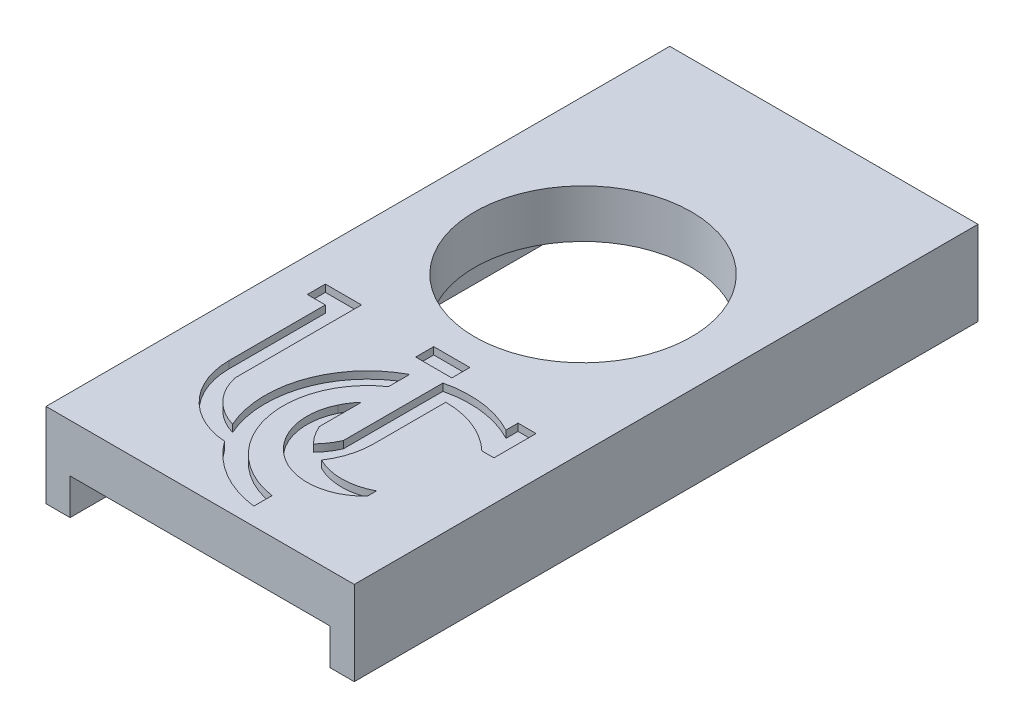
from build123d import *

# Parameters (mm, degrees)
SKETCH1_W           = 12.8
SKETCH1_H           = 25.9
SKETCH1_W_2         = 10.8
SKETCH1_H_2         = 21.9
BOSS_EXTRUDE1_DEPTH = 3.5
SKETCH3_W           = 10.8
SKETCH3_H           = 1.5
CUT_EXTRUDE1_DEPTH  = 15.863125512
SKETCH4_W           = 10.8
SKETCH4_H           = 21.9
SKETCH4_R           = 4.5
BOSS_EXTRUDE2_DEPTH = 2
SKETCH5_W           = 1.5
SKETCH5_H           = 0.75
CUT_EXTRUDE2_DEPTH  = 0.3


with BuildPart() as part:
    # Sketch1 → Boss-Extrude1 (new body)
    with BuildSketch(Plane(origin=(0, 0, 0), x_dir=(1, 0, 0), z_dir=(0, 1, 0))):
        Rectangle(SKETCH1_W, SKETCH1_H)
        Rectangle(SKETCH1_W_2, SKETCH1_H_2, mode=Mode.SUBTRACT)
    extrude(amount=BOSS_EXTRUDE1_DEPTH)

    # Sketch3 → Cut-Extrude1 (cut, through all)
    with BuildSketch(Plane.XY):
        with Locations((0, 0.75)):
            Rectangle(SKETCH3_W, SKETCH3_H)
    extrude(amount=CUT_EXTRUDE1_DEPTH, mode=Mode.SUBTRACT)

    # Sketch4 → Boss-Extrude2 (add)
    with BuildSketch(Plane(origin=(0, 3.5, 0), x_dir=(1, 0, 0), z_dir=(0, 1, 0))):
        Rectangle(SKETCH4_W, SKETCH4_H)
        with Locations(Location((0, 2.95, 0), (0, 0, 270))):
            Circle(SKETCH4_R, mode=Mode.SUBTRACT)
    extrude(amount=-BOSS_EXTRUDE2_DEPTH)

    # Sketch5 → Cut-Extrude2 (cut)
    with BuildSketch(Plane(origin=(0, 3.5, 0), x_dir=(1, 0, 0), z_dir=(0, 1, 0))):
        with BuildLine():
            Line((0, -6.25), (0, -8))
            ThreePointArc((0, -8), (0.216665991, -8.397222673), (0.5, -8.75))
            ThreePointArc((0.5, -8.75), (0.783334009, -8.397222673), (1, -8))
            Line((1, -8), (1, -3.86932209))
            ThreePointArc((1, -3.86932209), (2.535003662, -3.783808462), (4, -4.25))
            Line((4, -4.25), (4, -3.75))
            Line((4, -3.75), (4.75, -3.75))
            Line((4.75, -3.75), (4.75, -5.5))
            Line((4.75, -5.5), (4.25, -5.5))
            ThreePointArc((4.25, -5.5), (3.096291202, -4.759271996), (1.75, -4.5))
            Line((1.75, -4.5), (1.75, -7.5))
            ThreePointArc((1.75, -7.5), (1.622281323, -8.366025404), (1.25, -9.158312395))
            ThreePointArc((1.25, -9.158312395), (2.379117111, -9.416714281), (3.5, -9.124655157))
            Line((3.5, -9.124655157), (3.5, -9.5))
            ThreePointArc((3.5, -9.5), (0.408776976, -9.847754603), (-0.391896371, -6.841841224))
            ThreePointArc((-0.391896371, -6.841841224), (-0.215797248, -6.532777264), (0, -6.25))
        make_face()
        with BuildLine():
            Line((-4.25, -3.5), (-4.25, -7.5))
            ThreePointArc((-4.25, -7.5), (-3.437933175, -9.552546813), (-1.44136772, -10.493890178))
            ThreePointArc((-1.44136772, -10.493890178), (-0.151482732, -11.665190589), (1.5, -12.220485754))
            Line((1.5, -12.220485754), (1.5, -11.464101615))
            ThreePointArc((1.5, -11.464101615), (-1.405868052, -8.80626473), (0, -5.127718677))
            Line((0, -5.127718677), (0, -4.25))
            ThreePointArc((0, -4.25), (-2.016828361, -6.611623278), (-1.88878465, -9.714600228))
            ThreePointArc((-1.88878465, -9.714600228), (-2.929652546, -9.0783749), (-3.5, -8))
            Line((-3.5, -8), (-3.5, -2.75))
            Line((-3.5, -2.75), (-5, -2.75))
            Line((-5, -2.75), (-5, -3.5))
            Line((-5, -3.5), (-4.25, -3.5))
        make_face()
        with Locations((0.25, -3.125)):
            Rectangle(SKETCH5_W, SKETCH5_H)
    extrude(amount=-CUT_EXTRUDE2_DEPTH, mode=Mode.SUBTRACT)


solid = part.part
